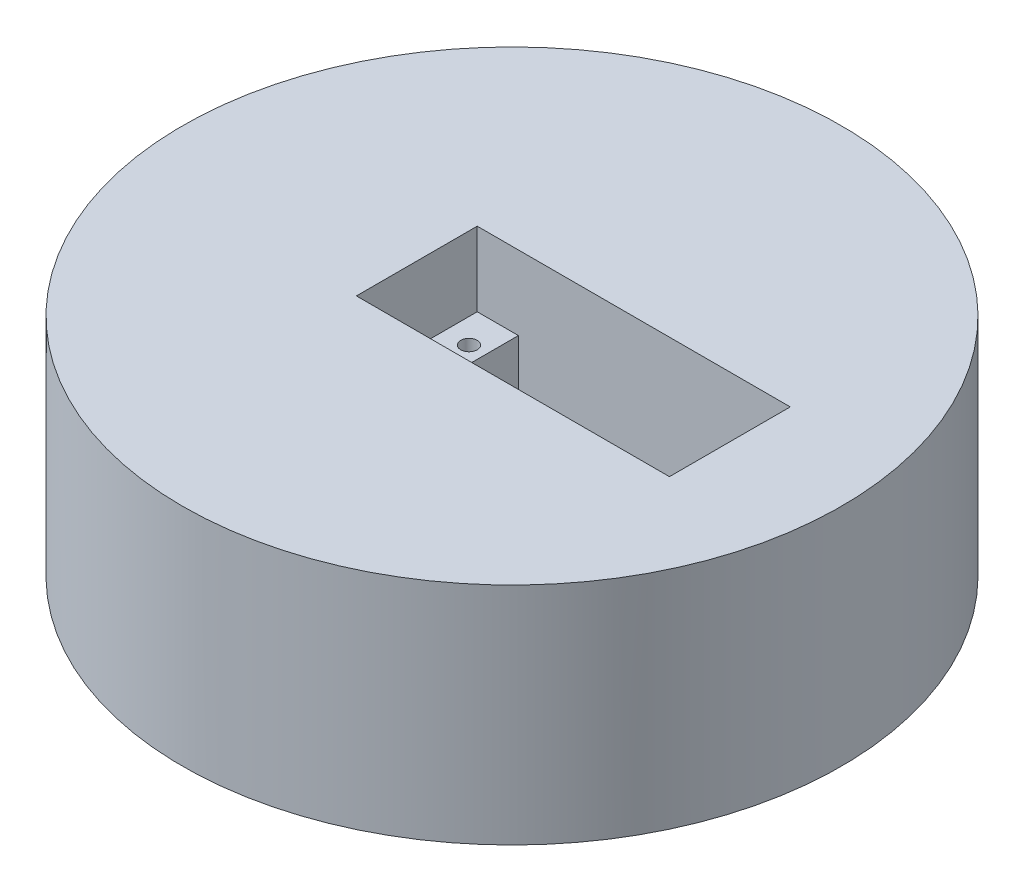
from build123d import *

# Parameters (mm, degrees)
SKETCH1_W             = 7.5
SKETCH1_H             = 22
SKETCH1_R             = 1.5
BOSS_EXTRUDE2_DEPTH   = 27.5
BOSS_EXTRUDE2_2_DEPTH = 27.5
SKETCH1_5_R           = 60
BOSS_EXTRUDE3_DEPTH   = 41
SKETCH1_7_W           = 7.5
SKETCH1_7_H           = 22
SKETCH1_7_R           = 1.5
CUT_EXTRUDE1_DEPTH    = 15
SKETCH2_W             = 56.358839631
SKETCH2_H             = 22
CUT_EXTRUDE2_DEPTH    = 15


with BuildPart() as part:
    # Sketch1 → Boss-Extrude2 (new body)
    with BuildSketch(Plane(origin=(0, 0, 0), x_dir=(1, 0, 0), z_dir=(0, 1, 0))):
        with Locations((24.75, 0)):
            Rectangle(SKETCH1_W, SKETCH1_H)
        with Locations((24, -5)):
            Circle(SKETCH1_R, mode=Mode.SUBTRACT)
        with Locations((24, 5)):
            Circle(SKETCH1_R, mode=Mode.SUBTRACT)
    extrude(amount=BOSS_EXTRUDE2_DEPTH)



with BuildPart() as body_2:
    # Sketch1 → Boss-Extrude2 2 (new body)
    with BuildSketch(Plane(origin=(0, 0, 0), x_dir=(1, 0, 0), z_dir=(0, 1, 0))):
        with Locations((-24.75, 0)):
            Rectangle(SKETCH1_W, SKETCH1_H)
        with Locations((-24, -5)):
            Circle(SKETCH1_R, mode=Mode.SUBTRACT)
        with Locations((-24, 5)):
            Circle(SKETCH1_R, mode=Mode.SUBTRACT)
    extrude(amount=BOSS_EXTRUDE2_2_DEPTH)


with BuildPart() as part_1:
    add(part.part)

    add(body_2.part)  # Boss-Extrude3 merges body 2
    # Sketch1<5> → Boss-Extrude3 (add)
    with BuildSketch(Plane(origin=(0, 0, 0), x_dir=(1, 0, 0), z_dir=(0, 1, 0))):
        with Locations((-11.17, 0)):
            Circle(SKETCH1_5_R)
        Polygon((28.5, -11), (21, -11), (-21, -11), (-28.5, -11), (-28.5, 11), (-21, 11), (21, 11), (28.5, 11), align=None, mode=Mode.SUBTRACT)
    extrude(amount=BOSS_EXTRUDE3_DEPTH)

    # Sketch1<7> → Cut-Extrude1 (cut)
    # profile 1 of 2: a face of its own
    with BuildSketch(Plane(origin=(0, 0, 0), x_dir=(1, 0, 0), z_dir=(0, 1, 0))):
        with Locations((24.75, 0)):
            Rectangle(SKETCH1_7_W, SKETCH1_7_H)
        with Locations((24, -5)):
            Circle(SKETCH1_7_R, mode=Mode.SUBTRACT)
        with Locations((24, 5)):
            Circle(SKETCH1_7_R, mode=Mode.SUBTRACT)
    # profile 2 of 2: a face of its own
    with BuildSketch(Plane(origin=(0, 0, 0), x_dir=(1, 0, 0), z_dir=(0, 1, 0))):
        with Locations((-24.75, 0)):
            Rectangle(SKETCH1_7_W, SKETCH1_7_H)
        with Locations((-24, -5)):
            Circle(SKETCH1_7_R, mode=Mode.SUBTRACT)
        with Locations((-24, 5)):
            Circle(SKETCH1_7_R, mode=Mode.SUBTRACT)
    extrude(amount=CUT_EXTRUDE1_DEPTH, mode=Mode.SUBTRACT)

    # Sketch2 → Cut-Extrude2 (cut)
    with BuildSketch(Plane.XZ):
        with Locations((-56.679419816, 0)):
            Rectangle(SKETCH2_W, SKETCH2_H)
    extrude(amount=-CUT_EXTRUDE2_DEPTH, mode=Mode.SUBTRACT)


solid = part_1.part
